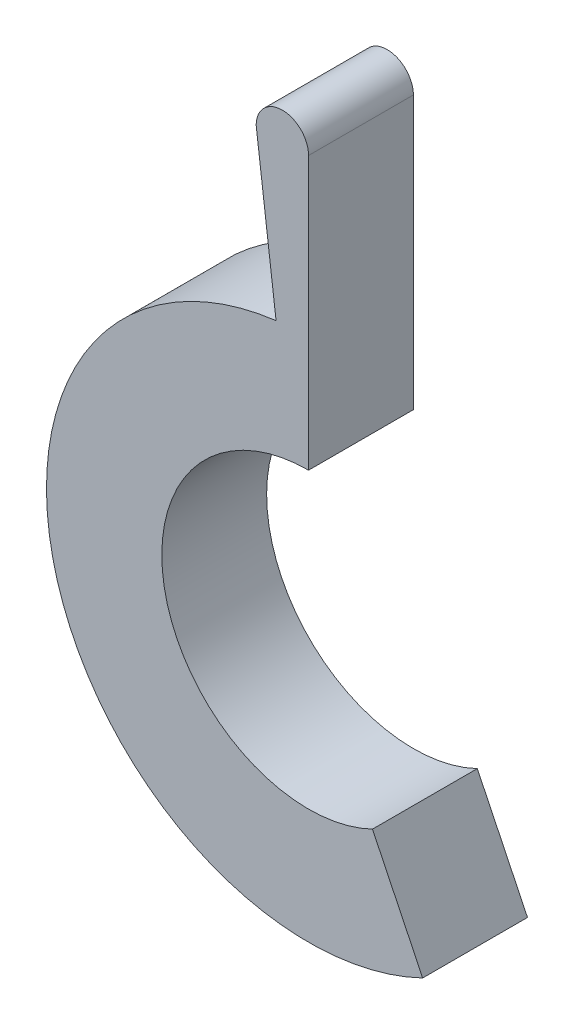
from build123d import *

# Parameters (mm, degrees)
RESSALTO_EXTRUS_O1_DEPTH = 10


with BuildPart() as part:
    # Esboço1 → Ressalto-extrusão1 (new body)
    with BuildSketch(Plane.XY):
        with BuildLine():
            Line((0, 14), (0, 20))
            Line((0, 20), (0, 40))
            ThreePointArc((0, 40), (-2.5, 42.5), (-5, 40))
            Line((-5, 40), (-4.923076923, 39.384615385))
            Line((-4.923076923, 39.384615385), (-3.100868365, 24.806946918))
            ThreePointArc((-3.100868365, 24.806946918), (-23.974598976, -7.086508587), (10.8841791, -22.506324563))
            Line((10.8841791, -22.506324563), (6.095140296, -12.603541755))
            ThreePointArc((6.095140296, -12.603541755), (-13.646420494, -3.126532858), (0, 14))
        make_face()
    extrude(amount=RESSALTO_EXTRUS_O1_DEPTH)


solid = part.part
